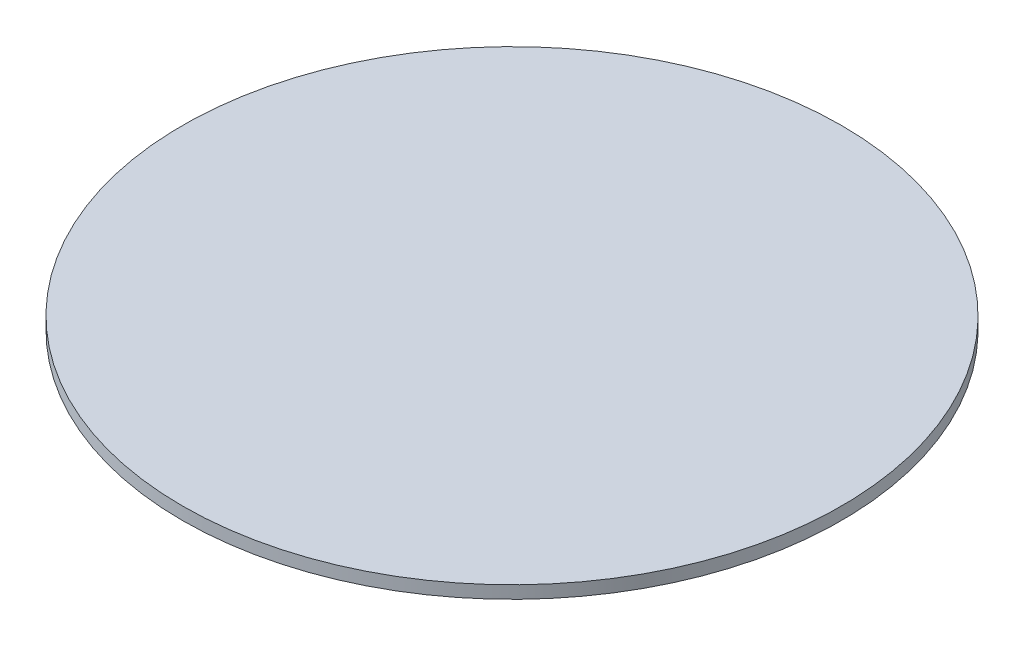
from build123d import *

# Parameters (mm, degrees)
SKETCH1_R           = 78.35
BOSS_EXTRUDE1_DEPTH = 3


with BuildPart() as part:
    # Sketch1 → Boss-Extrude1 (new body)
    with BuildSketch(Plane(origin=(0, 0, 0), x_dir=(1, 0, 0), z_dir=(0, 1, 0))):
        with Locations(Location((0, 0, 0), (0, 0, 270))):
            Circle(SKETCH1_R)
    extrude(amount=BOSS_EXTRUDE1_DEPTH)


solid = part.part
